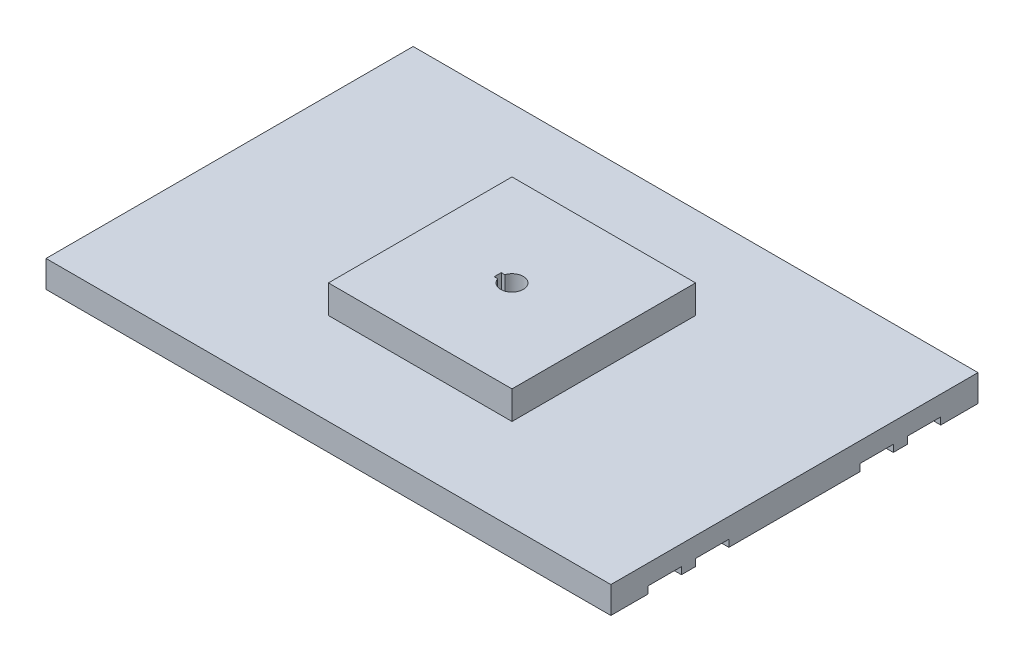
from build123d import *

# Parameters (mm, degrees)
SKETCH1_W           = 400
SKETCH1_H           = 260
BOSS_EXTRUDE1_DEPTH = 19
SKETCH2_W           = 400
SKETCH2_H           = 23.6
CUT_EXTRUDE1_DEPTH  = 5
SKETCH4_W           = 130
SKETCH4_H           = 130
BOSS_EXTRUDE4_DEPTH = 20
SKETCH5_R           = 8
CUT_EXTRUDE2_DEPTH  = 242.704364876
SKETCH6_W           = 2.5
SKETCH6_H           = 5
CUT_EXTRUDE4_DEPTH  = 242.704364876
SKETCH7_R           = 25
CUT_EXTRUDE5_DEPTH  = 19


with BuildPart() as part:
    # Sketch1 → Boss-Extrude1 (new body)
    with BuildSketch(Plane(origin=(0, 0, 0), x_dir=(1, 0, 0), z_dir=(0, 1, 0))):
        Rectangle(SKETCH1_W, SKETCH1_H)
    extrude(amount=BOSS_EXTRUDE1_DEPTH)

    # Sketch2 → Cut-Extrude1 (cut)
    with BuildSketch(Plane.XZ):
        with Locations((0, 91.8)):
            Rectangle(SKETCH2_W, SKETCH2_H)
        with Locations((0, 58.2)):
            Rectangle(SKETCH2_W, SKETCH2_H)
        with Locations((0, -58.2)):
            Rectangle(SKETCH2_W, SKETCH2_H)
        with Locations((0, -91.8)):
            Rectangle(SKETCH2_W, SKETCH2_H)
    extrude(amount=-CUT_EXTRUDE1_DEPTH, mode=Mode.SUBTRACT)

    # Sketch4 → Boss-Extrude4 (add)
    with BuildSketch(Plane(origin=(0, 19, 0), x_dir=(1, 0, 0), z_dir=(0, 1, 0))):
        Rectangle(SKETCH4_W, SKETCH4_H)
    extrude(amount=BOSS_EXTRUDE4_DEPTH)

    # Sketch5 → Cut-Extrude2 (cut, through all)
    with BuildSketch(Plane(origin=(0, 39, 0), x_dir=(1, 0, 0), z_dir=(0, 1, 0))):
        with Locations(Location((0, 0, 0), (0, 0, 270))):
            Circle(SKETCH5_R)
    extrude(amount=-CUT_EXTRUDE2_DEPTH, mode=Mode.SUBTRACT)

    # Sketch6 → Cut-Extrude4 (cut, through all)
    with BuildSketch(Plane(origin=(0, 39, 0), x_dir=(1, 0, 0), z_dir=(0, 1, 0))):
        with Locations((-8.849342077, 0)):
            Rectangle(SKETCH6_W, SKETCH6_H)
    extrude(amount=-CUT_EXTRUDE4_DEPTH, mode=Mode.SUBTRACT)

    # Sketch7 → Cut-Extrude5 (cut)
    with BuildSketch(Plane.XZ):
        with Locations(Location((0, 0, 0), (0, 0, 270))):
            Circle(SKETCH7_R)
    extrude(amount=-CUT_EXTRUDE5_DEPTH, mode=Mode.SUBTRACT)


solid = part.part
